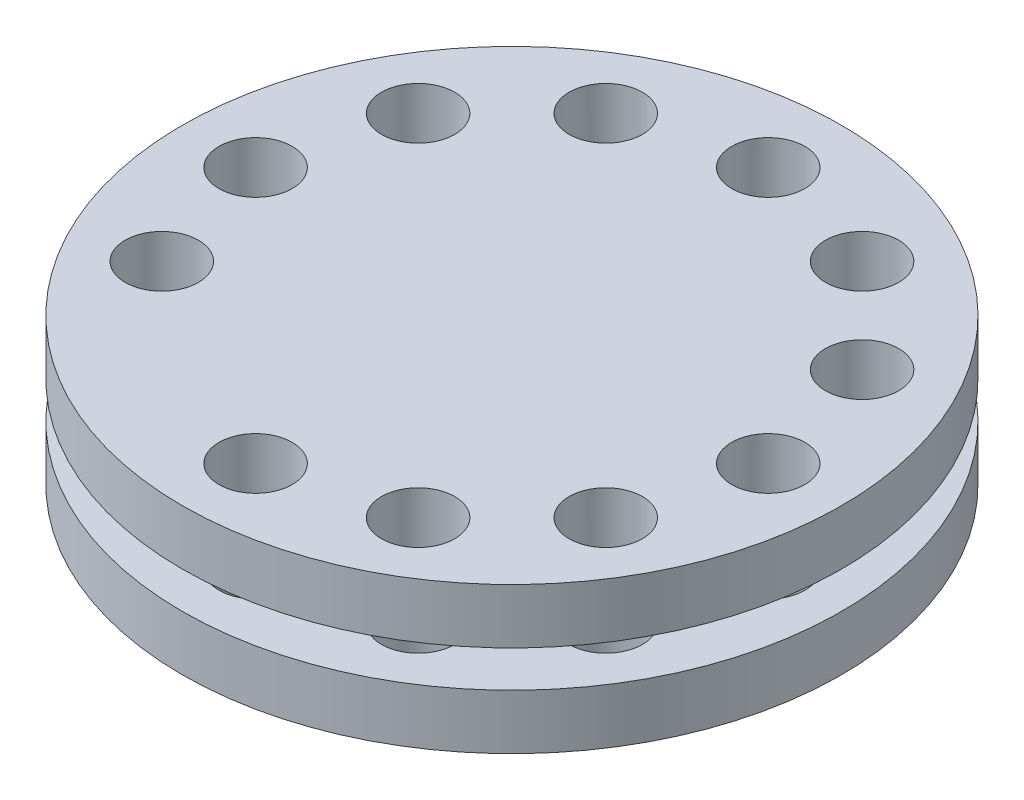
from build123d import *

# Parameters (mm, degrees)
SKETCH1_R           = 9
BOSS_EXTRUDE1_DEPTH = 1.5
SKETCH2_R           = 5
BOSS_EXTRUDE2_DEPTH = 1
SKETCH3_R           = 9
BOSS_EXTRUDE3_DEPTH = 1.5
SKETCH4_R           = 1
CUT_EXTRUDE1_DEPTH  = 14.341664064
BOSS_EXTRUDE4_START = -4
SKETCH6_R           = 1
BOSS_EXTRUDE4_DEPTH = 4


with BuildPart() as part:
    # Sketch1 → Boss-Extrude1 (new body)
    with BuildSketch(Plane(origin=(0, 0, 0), x_dir=(1, 0, 0), z_dir=(0, 1, 0))):
        with Locations(Location((0, 0, 0), (0, 0, 270))):
            Circle(SKETCH1_R)
    extrude(amount=BOSS_EXTRUDE1_DEPTH)

    # Sketch2 → Boss-Extrude2 (add)
    with BuildSketch(Plane(origin=(0, 1.5, 0), x_dir=(1, 0, 0), z_dir=(0, 1, 0))):
        with Locations(Location((0, 0, 0), (0, 0, 270))):
            Circle(SKETCH2_R)
    extrude(amount=BOSS_EXTRUDE2_DEPTH)

    # Sketch3 → Boss-Extrude3 (add)
    with BuildSketch(Plane(origin=(0, 2.5, 0), x_dir=(1, 0, 0), z_dir=(0, 1, 0))):
        with Locations(Location((0, 0, 0), (0, 0, 270))):
            Circle(SKETCH3_R)
    extrude(amount=BOSS_EXTRUDE3_DEPTH)

    # Sketch4 → Cut-Extrude1 (cut, through all)
    with BuildSketch(Plane.XZ):
        with Locations(Location((0, 7, 0), (0, 0, 270))):
            Circle(SKETCH4_R)
        with Locations(Location((3.5, 6.062177826, 0), (0, 0, 270))):
            Circle(SKETCH4_R)
        with Locations(Location((6.062177826, 3.5, 0), (0, 0, 270))):
            Circle(SKETCH4_R)
        with Locations(Location((7, 0, 0), (0, 0, 270))):
            Circle(SKETCH4_R)
        with Locations(Location((6.062177826, -3.5, 0), (0, 0, 270))):
            Circle(SKETCH4_R)
        with Locations(Location((3.5, -6.062177826, 0), (0, 0, 270))):
            Circle(SKETCH4_R)
        with Locations(Location((0, -7, 0), (0, 0, 270))):
            Circle(SKETCH4_R)
        with Locations(Location((-3.5, -6.062177826, 0), (0, 0, 270))):
            Circle(SKETCH4_R)
        with Locations(Location((-6.062177826, -3.5, 0), (0, 0, 270))):
            Circle(SKETCH4_R)
        with Locations(Location((-7, 0, 0), (0, 0, 270))):
            Circle(SKETCH4_R)
        with Locations(Location((-6.062177826, 3.5, 0), (0, 0, 270))):
            Circle(SKETCH4_R)
        with Locations(Location((-3.5, 6.062177826, 0), (0, 0, 270))):
            Circle(SKETCH4_R)
    extrude(amount=-CUT_EXTRUDE1_DEPTH, mode=Mode.SUBTRACT)

    # Sketch6 → Boss-Extrude4 (add)
    with BuildSketch(Plane(origin=(0, 4, 0), x_dir=(1, 0, 0), z_dir=(0, 1, 0)).offset(BOSS_EXTRUDE4_START)):
        with Locations(Location((-3.5, -6.062177826, 0), (0, 0, 270))):
            Circle(SKETCH6_R)
    extrude(amount=BOSS_EXTRUDE4_DEPTH)


solid = part.part
